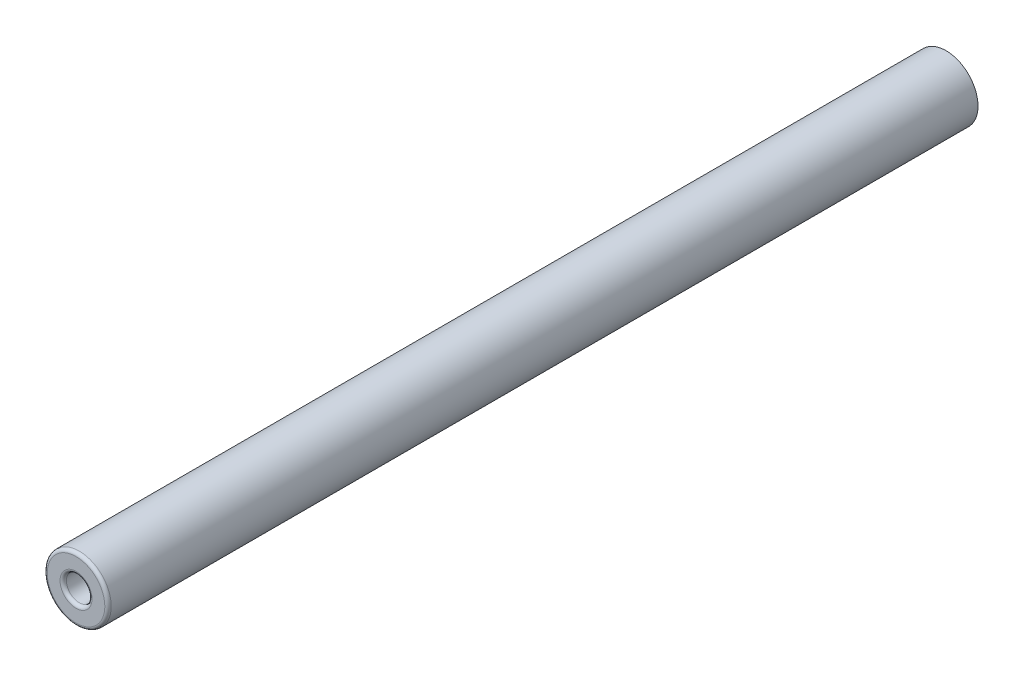
from build123d import *

# Parameters (mm, degrees)
SKETCH1_R           = 7.5
BOSS_EXTRUDE1_DEPTH = 204
SKETCH2_R           = 3
CUT_EXTRUDE1_DEPTH  = 30
FILLET1_R           = 0.75
ESCALA2_SCALE       = 0.5


with BuildPart() as part:
    # Sketch1 → Boss-Extrude1 (new body)
    with BuildSketch(Plane.XY):
        Circle(SKETCH1_R)
    extrude(amount=BOSS_EXTRUDE1_DEPTH)

    # Sketch2 → Cut-Extrude1 (cut)
    with BuildSketch(Plane.XY.offset(204)):
        Circle(SKETCH2_R)
    extrude(amount=-CUT_EXTRUDE1_DEPTH, mode=Mode.SUBTRACT)

    # Fillet1
    fillet1_edges = [part.edges().sort_by_distance(p)[0] for p in [
        (-7.5, 0, 204),
        (-3, 0, 204),
    ]]
    fillet(fillet1_edges, radius=FILLET1_R)


with BuildPart() as part_1:
    # Escala2: scaled about (0, 0, 99.880096597)
    add(part.part.scale(ESCALA2_SCALE).moved(Location((0, 0, 49.940048299))))


solid = part_1.part
